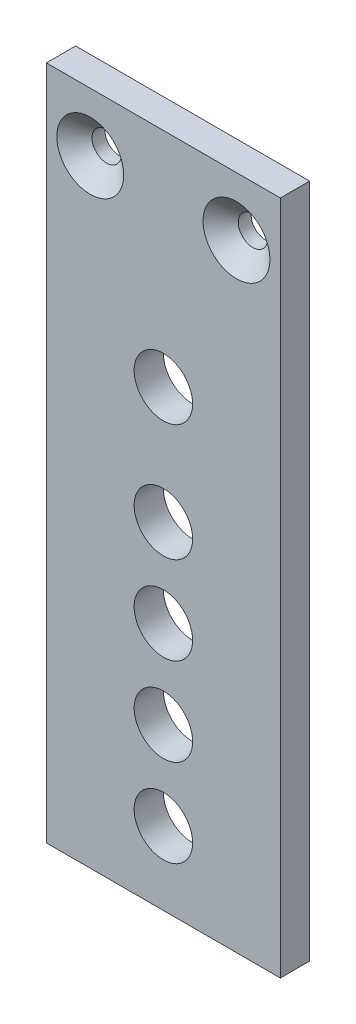
from build123d import *

# Parameters (mm, degrees)
SKETCH1_W           = 50.8
SKETCH1_H           = 146.685
SKETCH1_R           = 6.35
SKETCH1_R_2         = 3.175
BOSS_EXTRUDE3_DEPTH = 6.35
CHAMFER1_SIZE       = 4.0894
CHAMFER1_SIZE2      = 3.554861186
CHAMFER2_SIZE       = 4.0894
CHAMFER2_SIZE2      = 3.554861186


with BuildPart() as part:
    # Sketch1 → Boss-Extrude3 (new body)
    with BuildSketch(Plane.XY):
        with Locations((0, -73.3425)):
            Rectangle(SKETCH1_W, SKETCH1_H)
        with Locations((0, -130.81)):
            Circle(SKETCH1_R, mode=Mode.SUBTRACT)
        with Locations((0, -111.76)):
            Circle(SKETCH1_R, mode=Mode.SUBTRACT)
        with Locations((0, -92.71)):
            Circle(SKETCH1_R, mode=Mode.SUBTRACT)
        with Locations((0, -73.66)):
            Circle(SKETCH1_R, mode=Mode.SUBTRACT)
        with Locations((-15.875, -12.7)):
            Circle(SKETCH1_R_2, mode=Mode.SUBTRACT)
        with Locations((15.875, -12.7)):
            Circle(SKETCH1_R_2, mode=Mode.SUBTRACT)
        with Locations((0, -48.26)):
            Circle(SKETCH1_R, mode=Mode.SUBTRACT)
    extrude(amount=BOSS_EXTRUDE3_DEPTH)

    # Chamfer1
    chamfer1_edges = [part.edges().sort_by_distance(p)[0] for p in [
        (-19.05, -12.7, 6.35),
    ]]
    chamfer1_side = [part.faces().sort_by_distance(p)[0] for p in [
        (0, -145.132674995, 6.35),
    ]]
    chamfer(chamfer1_edges, length=CHAMFER1_SIZE, length2=CHAMFER1_SIZE2, reference=chamfer1_side[0])

    # Chamfer2
    chamfer2_edges = [part.edges().sort_by_distance(p)[0] for p in [
        (12.7, -12.7, 6.35),
    ]]
    chamfer2_side = [part.faces().sort_by_distance(p)[0] for p in [
        (-24.691725005, -12.7, 6.35),
    ]]
    chamfer(chamfer2_edges, length=CHAMFER2_SIZE, length2=CHAMFER2_SIZE2, reference=chamfer2_side[0])


solid = part.part
